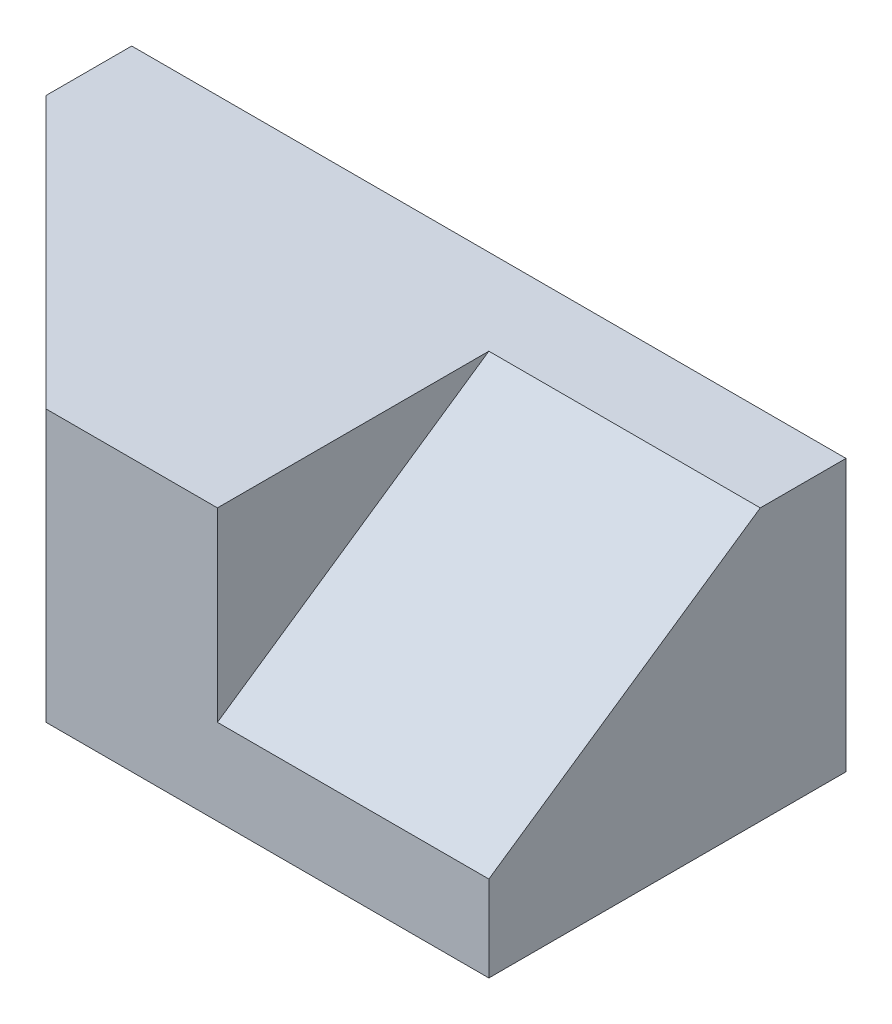
from build123d import *

# Parameters (mm, degrees)
BOSS_EXTRUDE1_DEPTH     = 38
CUT_EXTRUDE8_DEPTH      = 119.084715353
CUT_EXTRUDE8_DEPTH_BACK = 38


with BuildPart() as part:
    # Sketch1 → Boss-Extrude1 (new body)
    with BuildSketch(Plane(origin=(0, 0, 0), x_dir=(1, 0, 0), z_dir=(0, 1, 0))):
        Polygon((-100, 50), (-100, 38), (-62, 0), (0, 0), (0, 50), align=None)
    extrude(amount=BOSS_EXTRUDE1_DEPTH)

    # Sketch2 → Cut-Extrude8 (cut, two sides: drawn at the far end of the back side and taken through both)
    with BuildSketch(Plane(origin=(0, 0, 0), x_dir=(0, 0, -1), z_dir=(1, 0, 0)).offset(-CUT_EXTRUDE8_DEPTH_BACK)):
        Polygon((139.275123153, 107.293505315), (38, 38), (0, 12), (-101.275123153, -57.293505315), (-239.862133784, 145.256740991), (0.688112523, 309.843751622), align=None)
    extrude(amount=CUT_EXTRUDE8_DEPTH + CUT_EXTRUDE8_DEPTH_BACK, mode=Mode.SUBTRACT)


solid = part.part
